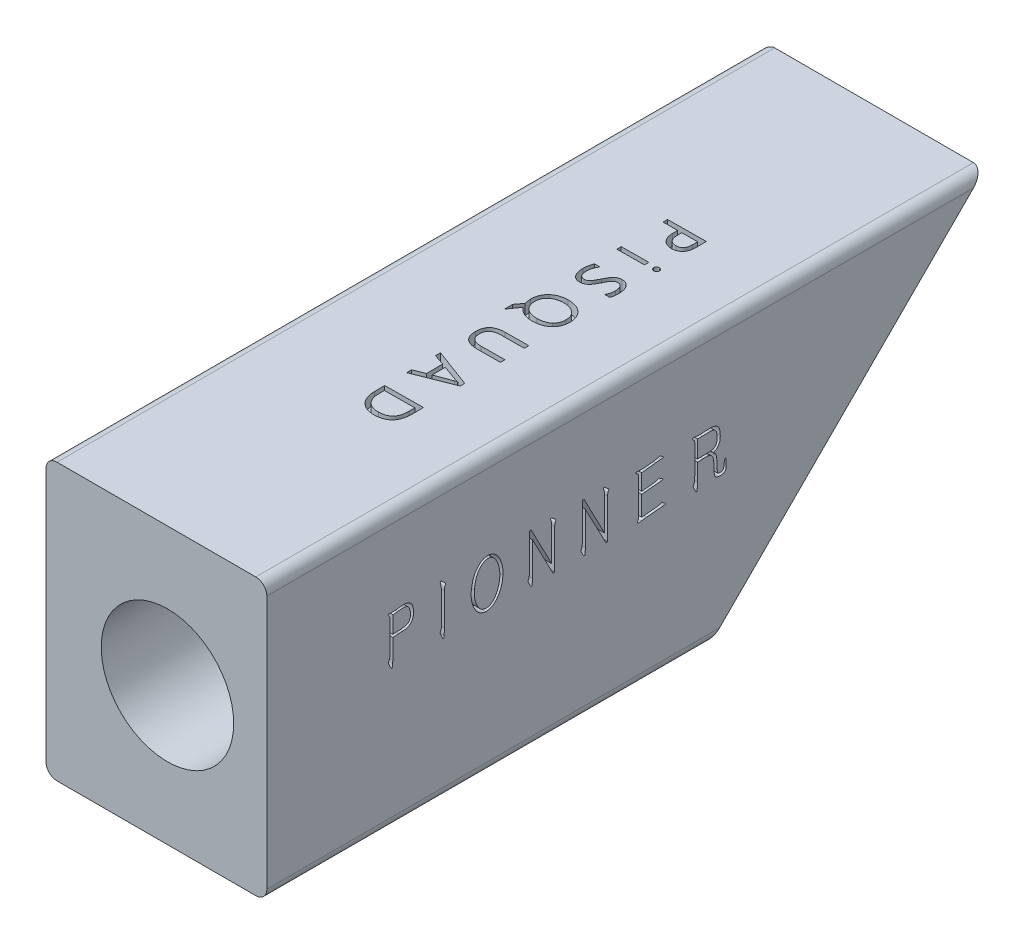
from build123d import *

# Parameters (mm, degrees)
SKETCH1_W               = 40
SKETCH1_H               = 25
BOSS_EXTRUDE1_DEPTH     = 20
CUT_EXTRUDE1_DEPTH      = 43
CUT_EXTRUDE1_DEPTH_BACK = 67
SKETCH2_R               = 6
FILLET1_R               = 1
SKETCH4_R               = 11
CUT_EXTRUDE2_DEPTH      = 2
CUT_EXTRUDE3_DEPTH      = 1
CUT_EXTRUDE4_DEPTH      = 1


with BuildPart() as part:
    # Sketch1 → Boss-Extrude1 (new body)
    with BuildSketch(Plane(origin=(0, 0, 0), x_dir=(0, 0, -1), z_dir=(1, 0, 0))):
        Polygon((20, 12.5), (45, 12.5), (20, -12.5), align=None)
        Rectangle(SKETCH1_W, SKETCH1_H)
    extrude(amount=BOSS_EXTRUDE1_DEPTH)

    # Sketch2 → Cut-Extrude1 (cut, two sides: drawn at the far end of the back side and taken through both)
    with BuildSketch(Plane.XY.offset(-CUT_EXTRUDE1_DEPTH_BACK)):
        with Locations(Location((11, 0, 0), (0, 0, 90))):
            Circle(SKETCH2_R)
    extrude(amount=CUT_EXTRUDE1_DEPTH + CUT_EXTRUDE1_DEPTH_BACK, mode=Mode.SUBTRACT)

    # Fillet1
    fillet1_edges = [part.edges().sort_by_distance(p)[0] for p in [
        (20, -12.5, 0),
        (20, 12.5, -12.5),
        (0, -12.5, 0),
        (0, 12.5, -12.5),
    ]]
    fillet(fillet1_edges, radius=FILLET1_R)

    # Sketch4 → Cut-Extrude2 (cut)
    with BuildSketch(Plane.ZY):
        Circle(SKETCH4_R)
    extrude(amount=-CUT_EXTRUDE2_DEPTH, mode=Mode.SUBTRACT)

    # Sketch5 → Cut-Extrude3 (cut)
    # profile 1 of 8: a face of its own
    with BuildSketch(Plane(origin=(0, 12.5, 0), x_dir=(1, 0, 0), z_dir=(0, 1, 0))):
        with BuildLine():
            Line((10.923109963, 26.290796431), (9.607012101, 26.279283273))
            Line((9.607012101, 26.279283273), (9.604133812, 26.687280806))
            Line((9.604133812, 26.687280806), (13.086864075, 26.717502846))
            Line((13.086864075, 26.717502846), (13.094779371, 25.761191168))
            add(Edge.make_bspline(
                [(13.094779371, 25.761191168), (13.094474458, 25.71583244), (13.093881285, 25.627592282), (13.082162329, 25.499148523), (13.062346751, 25.378533615), (13.033475802, 25.265603452), (12.996458274, 25.160313113), (12.949895034, 25.063015403), (12.895281765, 24.97324397), (12.831641437, 24.892038866), (12.761295356, 24.818410817), (12.681851906, 24.756070948), (12.596804189, 24.701216734), (12.503715053, 24.657485912), (12.40417014, 24.622668103), (12.297153221, 24.598762166), (12.183584935, 24.582257996), (12.105189105, 24.580059045), (12.065071312, 24.578933767)],
                knots=[0, 0, 0, 0, 1.221701374, 2.376678736, 3.470994319, 4.511770909, 5.513366762, 6.473054638, 7.412954823, 8.338548984, 9.248029584, 10.149322212, 11.052905708, 11.969248683, 12.913493508, 13.888572598, 14.919511302, 16, 16, 16, 16], degree=3))
            add(Edge.make_bspline(
                [(12.065071312, 24.578933767), (12.024726222, 24.579575067), (11.945414418, 24.580835757), (11.829219323, 24.596345284), (11.718453132, 24.622020727), (11.613670073, 24.659091377), (11.513932969, 24.705960715), (11.420401823, 24.764697), (11.331931996, 24.833652503), (11.249434204, 24.912473878), (11.174802559, 25.00068962), (11.109579628, 25.097265938), (11.054075883, 25.201169338), (11.008463387, 25.312791764), (10.973486006, 25.432243458), (10.947626032, 25.559063142), (10.931758536, 25.693401745), (10.9288933, 25.785374201), (10.927427398, 25.832428832)],
                knots=[0, 0, 0, 0, 1.016311944, 1.997901951, 2.948142108, 3.877399555, 4.794143846, 5.72015072, 6.654957076, 7.617047025, 8.590842581, 9.561706143, 10.548921141, 11.554840612, 12.595425369, 13.68148555, 14.813809629, 16, 16, 16, 16], degree=3))
            Line((10.927427398, 25.832428832), (10.923109963, 26.290796431))
        make_face()
        with BuildLine():
            Line((12.72060174, 26.306627023), (11.292250588, 26.293674721))
            Line((11.292250588, 26.293674721), (11.296568023, 25.866248734))
            add(Edge.make_bspline(
                [(11.296568023, 25.866248734), (11.29725283, 25.832158778), (11.29858698, 25.765744364), (11.309076975, 25.66938031), (11.324277398, 25.578987084), (11.347038554, 25.495463595), (11.373789682, 25.417703219), (11.408164196, 25.346852887), (11.447439522, 25.28144993), (11.493917783, 25.223233676), (11.544971318, 25.170976342), (11.601555423, 25.126056), (11.663158287, 25.088316431), (11.729821104, 25.05826375), (11.800921807, 25.034406571), (11.876754051, 25.016868184), (11.957871057, 25.007844882), (12.013482028, 25.006863706), (12.042044996, 25.006359753)],
                knots=[0, 0, 0, 0, 1.263550358, 2.461662288, 3.590338682, 4.658096108, 5.66784211, 6.63437192, 7.572333741, 8.490354779, 9.389576543, 10.275642468, 11.161753016, 12.061106685, 12.980676982, 13.938494696, 14.941167359, 16, 16, 16, 16], degree=3))
            add(Edge.make_bspline(
                [(12.042044996, 25.006359753), (12.06989833, 25.007369037), (12.124103965, 25.009333214), (12.202653991, 25.019319641), (12.275810768, 25.035604014), (12.343129516, 25.05905626), (12.405806558, 25.087322294), (12.462020395, 25.124069602), (12.513737097, 25.165728752), (12.559380365, 25.214469373), (12.599163887, 25.269797526), (12.633451177, 25.331272658), (12.663594437, 25.398421975), (12.685719357, 25.47268161), (12.705158593, 25.552484036), (12.716520914, 25.639313595), (12.723965673, 25.73203324), (12.724595317, 25.795953589), (12.724919174, 25.828830971)],
                knots=[0, 0, 0, 0, 1.092760076, 2.126630679, 3.10114116, 4.026408532, 4.918709526, 5.790338198, 6.652831066, 7.518039001, 8.40061612, 9.318970533, 10.275144277, 11.280851964, 12.353378912, 13.49358346, 14.710826645, 16, 16, 16, 16], degree=3))
            Line((12.724919174, 25.828830971), (12.72060174, 26.306627023))
        make_face(mode=Mode.SUBTRACT)
    # profile 2 of 8: a face of its own
    with BuildSketch(Plane(origin=(0, 12.5, 0), x_dir=(1, 0, 0), z_dir=(0, 1, 0))):
        with BuildLine():
            add(Edge.make_bspline(
                [(12.759834072, 22.281493487), (12.760609371, 22.298850627), (12.762118773, 22.332642622), (12.775582932, 22.381395664), (12.798152782, 22.426102747), (12.830069304, 22.465109383), (12.867860731, 22.498979168), (12.91274339, 22.52243246), (12.961888259, 22.538745566), (12.996674329, 22.540405506), (13.01456269, 22.541259112)],
                knots=[0, 0, 0, 0, 1.025550426, 1.996607361, 2.967871765, 3.967656224, 4.963806558, 5.948258015, 6.944913882, 8, 8, 8, 8], degree=3))
            add(Edge.make_bspline(
                [(13.01456269, 22.541259112), (13.032636839, 22.540531691), (13.067671692, 22.539121662), (13.117955788, 22.525203407), (13.162604804, 22.500578456), (13.201846867, 22.468177588), (13.235295894, 22.429990811), (13.25847196, 22.385466485), (13.273708075, 22.337163882), (13.275546077, 22.303199047), (13.276487032, 22.285810921)],
                knots=[0, 0, 0, 0, 1.062516067, 2.059576563, 3.038979646, 4.042519484, 5.044269238, 6.004549144, 6.978439021, 8, 8, 8, 8], degree=3))
            add(Edge.make_bspline(
                [(13.276487032, 22.285810921), (13.276070036, 22.268193255), (13.275250671, 22.233575867), (13.260606541, 22.184123794), (13.238321792, 22.138106852), (13.205454502, 22.098643653), (13.167342729, 22.06416817), (13.121945559, 22.040393099), (13.072249011, 22.024266975), (13.037003149, 22.022590095), (13.018880124, 22.021727862)],
                knots=[0, 0, 0, 0, 1.022706302, 2.009540815, 2.978395056, 3.982499012, 4.98309483, 5.952453026, 6.947174454, 8, 8, 8, 8], degree=3))
            add(Edge.make_bspline(
                [(13.018880124, 22.021727862), (13.001748556, 22.022456058), (12.96810397, 22.023886157), (12.919653223, 22.038295793), (12.874749727, 22.061496587), (12.835665025, 22.094959855), (12.802477706, 22.134677466), (12.778755683, 22.18018458), (12.762416721, 22.229310584), (12.760707342, 22.263848887), (12.759834072, 22.281493487)],
                knots=[0, 0, 0, 0, 1.005736925, 1.97516089, 2.947457836, 3.959514003, 4.982437541, 5.973808908, 6.964878778, 8, 8, 8, 8], degree=3))
        make_face()
    # profile 3 of 8: a face of its own
    with BuildSketch(Plane(origin=(0, 12.5, 0), x_dir=(1, 0, 0), z_dir=(0, 1, 0))):
        Polygon((9.643366144, 22.059865198), (9.639768282, 22.45850829), (12.126610387, 22.480095461), (12.130208249, 22.081452369), align=None)
    # profile 4 of 8: a face of its own
    with BuildSketch(Plane(origin=(0, 12.5, 0), x_dir=(1, 0, 0), z_dir=(0, 1, 0))):
        with BuildLine():
            Line((9.802757307, 19.898366029), (10.28343165, 19.902683463))
            add(Edge.make_bspline(
                [(10.28343165, 19.902683463), (10.259752854, 19.872823779), (10.210203558, 19.810340605), (10.151765192, 19.70159033), (10.098532648, 19.583876825), (10.055207657, 19.45947972), (10.021612242, 19.331822326), (9.996797109, 19.20494271), (9.980705548, 19.082303403), (9.979101035, 19.00254225), (9.978332965, 18.964361094)],
                knots=[0, 0, 0, 0, 0.909527534, 1.903240743, 2.94027437, 3.997658092, 5.047879587, 6.093833657, 7.087530318, 8, 8, 8, 8], degree=3))
            add(Edge.make_bspline(
                [(9.978332965, 18.964361094), (9.978948799, 18.933883337), (9.98013859, 18.875000245), (9.987456882, 18.789712542), (9.998654913, 18.710585966), (10.014613947, 18.637260175), (10.034360608, 18.56972712), (10.058969843, 18.508063788), (10.087524668, 18.452375521), (10.120928713, 18.402900386), (10.158502805, 18.359528549), (10.199796032, 18.321876275), (10.244614844, 18.289478023), (10.294106927, 18.264943884), (10.346268708, 18.243829009), (10.40311653, 18.23095482), (10.463255013, 18.221650791), (10.504780654, 18.221247973), (10.525927538, 18.221042838)],
                knots=[0, 0, 0, 0, 1.394376791, 2.693938997, 3.913771134, 5.048124552, 6.124462512, 7.129099216, 8.081302708, 8.98223275, 9.853535778, 10.700234808, 11.53454018, 12.373810629, 13.221575718, 14.102568969, 15.033735525, 16, 16, 16, 16], degree=3))
            add(Edge.make_bspline(
                [(10.525927538, 18.221042838), (10.548773106, 18.221865899), (10.593129287, 18.223463926), (10.657299404, 18.236045017), (10.716591018, 18.256166447), (10.771531995, 18.283917456), (10.822002661, 18.31952949), (10.871083867, 18.359449447), (10.917220049, 18.406067788), (10.977420744, 18.477458287), (11.047608074, 18.58140394), (11.125623471, 18.721982599), (11.204367177, 18.877469492), (11.258492369, 18.985449171), (11.286515531, 19.041355338)],
                knots=[0, 0, 0, 0, 0.694754918, 1.348912603, 1.98133275, 2.594985317, 3.214469777, 3.857415669, 4.518015618, 5.206763897, 6.696836466, 8.324553812, 10.097048341, 12, 12, 12, 12], degree=3))
            add(Edge.make_bspline(
                [(11.286515531, 19.041355338), (11.316615209, 19.100546623), (11.375142892, 19.215641831), (11.452468456, 19.355119451), (11.516998873, 19.459024329), (11.567228346, 19.531011754), (11.619997764, 19.597665689), (11.675561517, 19.659165492), (11.734309558, 19.715488752), (11.797184153, 19.765344669), (11.863650735, 19.808752909), (11.934153697, 19.845762598), (12.009650059, 19.876912699), (12.091766084, 19.897839917), (12.180039249, 19.911112282), (12.240858068, 19.913144842), (12.272329676, 19.914196621)],
                knots=[0, 0, 0, 0, 1.991748835, 3.872880072, 4.781138777, 5.659323326, 6.504255845, 7.329384323, 8.143588483, 8.942454958, 9.732657316, 10.521089169, 11.32801381, 12.176095253, 13.05619322, 14, 14, 14, 14], degree=3))
            add(Edge.make_bspline(
                [(12.272329676, 19.914196621), (12.310763446, 19.913144469), (12.385680311, 19.911093568), (12.494476036, 19.89361782), (12.59490615, 19.860433434), (12.687661562, 19.815576941), (12.772226725, 19.759717046), (12.850393358, 19.696253101), (12.919298906, 19.622741431), (12.981586245, 19.542176242), (13.034752557, 19.453827642), (13.083376952, 19.360665852), (13.122163331, 19.260476958), (13.154574776, 19.155615469), (13.179266571, 19.04725644), (13.198193503, 18.937047094), (13.210000893, 18.82549628), (13.211873555, 18.750675642), (13.212810761, 18.713230338)],
                knots=[0, 0, 0, 0, 1.080537334, 2.106232892, 3.08527093, 4.044570117, 4.994935645, 5.929370513, 6.869242421, 7.821688023, 8.787627346, 9.764991097, 10.773262619, 11.803737319, 12.849223604, 13.895992789, 14.947012566, 16, 16, 16, 16], degree=3))
            add(Edge.make_bspline(
                [(13.212810761, 18.713230338), (13.21292615, 18.671728183), (13.213148356, 18.591806459), (13.207744769, 18.476134796), (13.199643611, 18.369000519), (13.186726076, 18.270545001), (13.170190124, 18.180696108), (13.15054465, 18.09948946), (13.126400577, 18.026536364), (13.105538465, 17.98244832), (13.095520465, 17.961277213)],
                knots=[0, 0, 0, 0, 1.297668763, 2.498952813, 3.620198206, 4.656646351, 5.602616275, 6.475845398, 7.268099954, 8, 8, 8, 8], degree=3))
            Line((13.095520465, 17.961277213), (12.636433294, 17.957679351))
            add(Edge.make_bspline(
                [(12.636433294, 17.957679351), (12.653525761, 17.984230763), (12.687876323, 18.037590872), (12.729900257, 18.124041889), (12.766149713, 18.215144151), (12.7957618, 18.311834355), (12.817712134, 18.414214287), (12.833385372, 18.521662506), (12.843178135, 18.63437284), (12.843503602, 18.711290887), (12.843670136, 18.750648101)],
                knots=[0, 0, 0, 0, 0.909905766, 1.82862863, 2.766268587, 3.735546208, 4.740876976, 5.782666551, 6.865440926, 8, 8, 8, 8], degree=3))
            add(Edge.make_bspline(
                [(12.843670136, 18.750648101), (12.841728935, 18.795344346), (12.83783411, 18.88502283), (12.818843548, 18.99572955), (12.797045217, 19.082063167), (12.776895212, 19.143877459), (12.749978089, 19.201023848), (12.721199504, 19.255455517), (12.686390225, 19.304757772), (12.647984038, 19.350464781), (12.604188218, 19.390227271), (12.556374381, 19.425485979), (12.503329422, 19.454039785), (12.444561594, 19.474143969), (12.3802469, 19.48575982), (12.33570121, 19.486899718), (12.312625729, 19.487490206)],
                knots=[0, 0, 0, 0, 1.845434707, 3.702677691, 4.62241544, 5.521019363, 6.380592896, 7.226891474, 8.059114754, 8.86670774, 9.686588796, 10.494606529, 11.314068988, 12.162623364, 13.048205344, 14, 14, 14, 14], degree=3))
            add(Edge.make_bspline(
                [(12.312625729, 19.487490206), (12.290996579, 19.486798259), (12.249169927, 19.485460165), (12.188748243, 19.475189357), (12.132992811, 19.458587804), (12.081291414, 19.436074366), (12.033313693, 19.407641609), (11.98812573, 19.373154285), (11.945075395, 19.332815023), (11.888855903, 19.269222471), (11.823063625, 19.174460917), (11.761871464, 19.069090612), (11.713718804, 18.974066097), (11.674244028, 18.895823836), (11.632383723, 18.812531102), (11.604494413, 18.755001017), (11.590175071, 18.725463068)],
                knots=[0, 0, 0, 0, 0.813813059, 1.573759345, 2.299300396, 2.998757306, 3.690892312, 4.393314638, 5.134307473, 5.908072096, 7.584180529, 9.465588082, 10.491221054, 11.593505116, 12.764421722, 14, 14, 14, 14], degree=3))
            add(Edge.make_bspline(
                [(11.590175071, 18.725463068), (11.559842003, 18.664217803), (11.499991728, 18.543374567), (11.417136843, 18.398486629), (11.349086899, 18.287897202), (11.294026703, 18.212036671), (11.237316056, 18.140118425), (11.176875996, 18.07408067), (11.113669349, 18.013431628), (11.047200269, 17.959018579), (10.977092115, 17.911415889), (10.903552412, 17.869940132), (10.825385288, 17.836244878), (10.741420781, 17.81275177), (10.652200483, 17.796991553), (10.590519193, 17.795233828), (10.559027867, 17.794336423)],
                knots=[0, 0, 0, 0, 1.949593011, 3.846748396, 4.760047279, 5.65265092, 6.519433597, 7.371997273, 8.204550148, 9.016858748, 9.81977283, 10.619413753, 11.422765192, 12.241534347, 13.102216949, 14, 14, 14, 14], degree=3))
            add(Edge.make_bspline(
                [(10.559027867, 17.794336423), (10.517696167, 17.794995261), (10.437719261, 17.796270113), (10.322740644, 17.814775278), (10.217074977, 17.844316453), (10.121916847, 17.888468162), (10.035732354, 17.94264729), (9.958567005, 18.006675741), (9.888469965, 18.078359202), (9.827552878, 18.159506838), (9.774167514, 18.247977164), (9.729831617, 18.344158563), (9.691333443, 18.445874701), (9.662333003, 18.554264287), (9.640497534, 18.667151417), (9.623840037, 18.783363577), (9.613691023, 18.902784262), (9.611660431, 18.983291056), (9.610631485, 19.024085601)],
                knots=[0, 0, 0, 0, 1.12803779, 2.182754968, 3.171987688, 4.116178941, 5.037932538, 5.945768266, 6.849431976, 7.770789505, 8.711426701, 9.667077362, 10.660295621, 11.679292766, 12.727967073, 13.800188193, 14.885307481, 16, 16, 16, 16], degree=3))
            add(Edge.make_bspline(
                [(9.610631485, 19.024085601), (9.611307771, 19.055040392), (9.612798689, 19.123282301), (9.621820483, 19.2325372), (9.636241039, 19.352440247), (9.658024825, 19.476034227), (9.684391701, 19.597865234), (9.712825047, 19.695406878), (9.737744663, 19.768422249), (9.757478097, 19.817181625), (9.779257587, 19.860073188), (9.795160397, 19.885986848), (9.802757307, 19.898366029)],
                knots=[0, 0, 0, 0, 1.027653548, 2.265531062, 3.63734406, 5.035411277, 6.430209537, 7.773321957, 8.40537434, 8.990927966, 9.517957508, 10, 10, 10, 10], degree=3))
        make_face()
    # profile 5 of 8: a face of its own
    with BuildSketch(Plane(origin=(0, 12.5, 0), x_dir=(1, 0, 0), z_dir=(0, 1, 0))):
        with BuildLine():
            add(Edge.make_bspline(
                [(9.651178492, 14.231161712), (9.652205713, 14.291193888), (9.654217949, 14.408791641), (9.676365635, 14.58083738), (9.712714399, 14.744112364), (9.764674913, 14.898667119), (9.832563783, 15.043968778), (9.916157793, 15.180036258), (10.014068919, 15.307996499), (10.090411534, 15.384253692), (10.128974544, 15.422773554)],
                knots=[0, 0, 0, 0, 1.088663926, 2.132596879, 3.140843327, 4.119310026, 5.08495698, 6.044031082, 7.011979729, 8, 8, 8, 8], degree=3))
            add(Edge.make_bspline(
                [(10.128974544, 15.422773554), (10.170265867, 15.458653008), (10.252763761, 15.530338274), (10.388893265, 15.622481334), (10.534274919, 15.700236164), (10.688510503, 15.765084254), (10.852540152, 15.813947615), (11.025417723, 15.851123282), (11.207763342, 15.873402383), (11.332518973, 15.877097838), (11.396141485, 15.878982435)],
                knots=[0, 0, 0, 0, 0.951506505, 1.901060033, 2.853701638, 3.817485097, 4.808025587, 5.828315939, 6.892490914, 8, 8, 8, 8], degree=3))
            add(Edge.make_bspline(
                [(11.396141485, 15.878982435), (11.46455688, 15.878464342), (11.59835351, 15.877451133), (11.793669429, 15.856426647), (11.978668147, 15.823284715), (12.152941354, 15.775105388), (12.316255687, 15.712258827), (12.469261588, 15.635896851), (12.61141322, 15.544308923), (12.697353319, 15.472388378), (12.740302669, 15.436445429)],
                knots=[0, 0, 0, 0, 1.132913998, 2.21558431, 3.249915805, 4.243956588, 5.206314499, 6.14467739, 7.072785566, 8, 8, 8, 8], degree=3))
            add(Edge.make_bspline(
                [(12.740302669, 15.436445429), (12.780586256, 15.398001215), (12.860662925, 15.321580897), (12.963532509, 15.191596306), (13.050933981, 15.051919389), (13.123881877, 14.902401386), (13.179661365, 14.742136438), (13.219639015, 14.571855846), (13.2456122, 14.391690486), (13.249306038, 14.267951243), (13.251199051, 14.204537534)],
                knots=[0, 0, 0, 0, 0.971198436, 1.930571267, 2.884445163, 3.84332438, 4.828647213, 5.840251103, 6.893174999, 8, 8, 8, 8], degree=3))
            add(Edge.make_bspline(
                [(13.251199051, 14.204537534), (13.250478367, 14.145940355), (13.24906711, 14.031194115), (13.226694162, 13.863461303), (13.190339331, 13.704248058), (13.138151472, 13.553489535), (13.071080295, 13.410994377), (12.988413066, 13.276996037), (12.890359178, 13.151425716), (12.814102952, 13.076632236), (12.775561715, 13.038830297)],
                knots=[0, 0, 0, 0, 1.082565615, 2.119902967, 3.121332615, 4.097375783, 5.063395109, 6.026999319, 7.002810778, 8, 8, 8, 8], degree=3))
            add(Edge.make_bspline(
                [(12.775561715, 13.038830297), (12.734506216, 13.003195705), (12.652476528, 12.931997095), (12.516936118, 12.840370383), (12.371672562, 12.763478324), (12.217296255, 12.699609579), (12.053553174, 12.650255547), (11.880447693, 12.61434884), (11.697990074, 12.591693829), (11.572982674, 12.588070497), (11.509114347, 12.586219277)],
                knots=[0, 0, 0, 0, 0.947040138, 1.892204683, 2.844298732, 3.807918914, 4.799940437, 5.820891907, 6.886658012, 8, 8, 8, 8], degree=3))
            add(Edge.make_bspline(
                [(11.509114347, 12.586219277), (11.439749462, 12.586815248), (11.304559586, 12.587976774), (11.107214195, 12.607765021), (10.921195081, 12.641402223), (10.745740483, 12.68845857), (10.581781112, 12.751483369), (10.428702609, 12.827928822), (10.28559101, 12.917652536), (10.200373358, 12.989798838), (10.157757439, 13.025877994)],
                knots=[0, 0, 0, 0, 1.143962991, 2.22954618, 3.267303387, 4.259919065, 5.221914841, 6.15986042, 7.079777032, 8, 8, 8, 8], degree=3))
            add(Edge.make_bspline(
                [(10.157757439, 13.025877994), (10.119458647, 13.061317097), (10.044157212, 13.130995935), (9.981855052, 13.212495115), (9.951240169, 13.25254329)],
                knots=[0, 0, 0, 0, 1.017212798, 2, 2, 2, 2], degree=3))
            Line((9.951240169, 13.25254329), (9.258291979, 12.267448718))
            Line((9.258291979, 12.267448718), (9.251815827, 13.007888685))
            Line((9.251815827, 13.007888685), (9.736088031, 13.668456119))
            add(Edge.make_bspline(
                [(9.736088031, 13.668456119), (9.723296924, 13.711917077), (9.69726725, 13.800359349), (9.672750622, 13.938579551), (9.655186299, 14.082729008), (9.652533578, 14.180974906), (9.651178492, 14.231161712)],
                knots=[0, 0, 0, 0, 0.951317699, 1.935914497, 2.945606265, 4, 4, 4, 4], degree=3))
        make_face()
        with BuildLine():
            add(Edge.make_bspline(
                [(12.882058426, 14.229722567), (12.880669301, 14.274425301), (12.877943759, 14.362134608), (12.856725149, 14.490001712), (12.825808296, 14.611940553), (12.780383656, 14.726682667), (12.724591806, 14.835730026), (12.654161198, 14.936812614), (12.573273784, 15.032753786), (12.510279709, 15.089126612), (12.478378327, 15.117674869)],
                knots=[0, 0, 0, 0, 1.063891147, 2.08741491, 3.079326943, 4.054070689, 5.019719015, 5.98927823, 6.981732772, 8, 8, 8, 8], degree=3))
            add(Edge.make_bspline(
                [(12.478378327, 15.117674869), (12.444413946, 15.145101026), (12.376647912, 15.199821938), (12.264196903, 15.267839084), (12.145379202, 15.326881416), (12.017685378, 15.373119713), (11.88305837, 15.410308265), (11.74033953, 15.434670198), (11.59055656, 15.450651789), (11.488050812, 15.451250689), (11.435717965, 15.451556448)],
                knots=[0, 0, 0, 0, 0.93525518, 1.866029459, 2.811540909, 3.776648883, 4.77370362, 5.802934709, 6.878319687, 8, 8, 8, 8], degree=3))
            add(Edge.make_bspline(
                [(11.435717965, 15.451556448), (11.383617641, 15.450220346), (11.281527975, 15.447602277), (11.132412252, 15.429835291), (10.990903187, 15.402760496), (10.857086597, 15.365555089), (10.731363828, 15.317192962), (10.613510874, 15.25840401), (10.502267482, 15.190602875), (10.435188099, 15.136203803), (10.401692472, 15.109040001)],
                knots=[0, 0, 0, 0, 1.124169595, 2.202790443, 3.236188269, 4.230866631, 5.195961516, 6.138088872, 7.070267524, 8, 8, 8, 8], degree=3))
            add(Edge.make_bspline(
                [(10.401692472, 15.109040001), (10.370801958, 15.080427331), (10.310031148, 15.024137714), (10.231327624, 14.929359811), (10.163822405, 14.829408939), (10.109476708, 14.722511694), (10.067492485, 14.609508294), (10.038160404, 14.490011208), (10.020452857, 14.36434103), (10.018933734, 14.278472373), (10.0181604, 14.234759573)],
                knots=[0, 0, 0, 0, 1.022999759, 2.012544204, 2.988047181, 3.950629948, 4.921413144, 5.913104128, 6.937632589, 8, 8, 8, 8], degree=3))
            add(Edge.make_bspline(
                [(10.0181604, 14.234759573), (10.019671925, 14.188158679), (10.02262168, 14.097216627), (10.041850634, 13.96471863), (10.07150649, 13.839889796), (10.113973433, 13.722844516), (10.166604627, 13.612814631), (10.2333962, 13.511844048), (10.30930954, 13.416720799), (10.369258214, 13.361661337), (10.399533755, 13.333854968)],
                knots=[0, 0, 0, 0, 1.107541294, 2.161376514, 3.176370973, 4.1520447, 5.115902815, 6.067901108, 7.024242986, 8, 8, 8, 8], degree=3))
            add(Edge.make_bspline(
                [(10.399533755, 13.333854968), (10.43181209, 13.307615535), (10.497039523, 13.254591398), (10.606752591, 13.189324479), (10.724337396, 13.132228871), (10.85222287, 13.088418468), (10.988253216, 13.052745213), (11.133995625, 13.028878409), (11.288608753, 13.014023212), (11.394906154, 13.013297607), (11.44938984, 13.012925692)],
                knots=[0, 0, 0, 0, 0.888630798, 1.795727863, 2.722741428, 3.680021302, 4.681662972, 5.727458161, 6.835188288, 8, 8, 8, 8], degree=3))
            add(Edge.make_bspline(
                [(11.44938984, 13.012925692), (11.505565359, 13.014270865), (11.614565493, 13.016880971), (11.77292559, 13.034110292), (11.92161616, 13.059057441), (12.059921996, 13.095979693), (12.188501803, 13.141942457), (12.306895515, 13.198209144), (12.416127653, 13.26401741), (12.480873475, 13.316991304), (12.512917801, 13.343209409)],
                knots=[0, 0, 0, 0, 1.185406818, 2.300103399, 3.358699395, 4.364325713, 5.31709008, 6.236387207, 7.127143925, 8, 8, 8, 8], degree=3))
            add(Edge.make_bspline(
                [(12.512917801, 13.343209409), (12.542925796, 13.370549152), (12.602324202, 13.424665969), (12.677939892, 13.518178854), (12.742512766, 13.618394693), (12.794435332, 13.726595378), (12.834854501, 13.841717107), (12.863673177, 13.96419465), (12.880524232, 14.094443453), (12.88153829, 14.183859056), (12.882058426, 14.229722567)],
                knots=[0, 0, 0, 0, 0.979966963, 1.939765557, 2.896635711, 3.856014001, 4.83330214, 5.840132684, 6.89214975, 8, 8, 8, 8], degree=3))
        make_face(mode=Mode.SUBTRACT)
    # profile 6 of 8: a face of its own
    with BuildSketch(Plane(origin=(0, 12.5, 0), x_dir=(1, 0, 0), z_dir=(0, 1, 0))):
        with BuildLine():
            add(Edge.make_bspline(
                [(11.17263268, 7.896234054), (11.113354908, 7.896589698), (10.998443221, 7.897279125), (10.83160753, 7.912136743), (10.676148947, 7.936005648), (10.531806178, 7.970411852), (10.398815982, 8.015467411), (10.277265052, 8.071755099), (10.16701653, 8.13810545), (10.068075228, 8.215039022), (9.980379094, 8.302606996), (9.904309266, 8.400976642), (9.840917786, 8.510536438), (9.787247783, 8.629377535), (9.746526315, 8.759209251), (9.717446005, 8.899024198), (9.698282652, 9.049192174), (9.695398742, 9.153026355), (9.693911463, 9.206575337)],
                knots=[0, 0, 0, 0, 1.255745004, 2.434298259, 3.545733077, 4.586248364, 5.574812864, 6.516297513, 7.419404238, 8.295855165, 9.16564817, 10.038983591, 10.922948769, 11.84211923, 12.796982904, 13.799883164, 14.865363819, 16, 16, 16, 16], degree=3))
            add(Edge.make_bspline(
                [(9.693911463, 9.206575337), (9.694553515, 9.257699569), (9.695801505, 9.357072532), (9.710792366, 9.501374235), (9.737472396, 9.635974908), (9.774423086, 9.761168989), (9.823569065, 9.876299192), (9.883746617, 9.981547066), (9.954470639, 10.0774758), (10.037237365, 10.162804575), (10.131094977, 10.238289028), (10.235968645, 10.303824212), (10.352057206, 10.359522832), (10.479386444, 10.404331191), (10.617480567, 10.440560431), (10.766811286, 10.465648539), (10.926874609, 10.482709452), (11.037306344, 10.485339576), (11.094199292, 10.48669458)],
                knots=[0, 0, 0, 0, 1.128084499, 2.192719487, 3.196710497, 4.153063646, 5.0685707, 5.953076793, 6.823432431, 7.69204742, 8.569283193, 9.475575022, 10.415611896, 11.405263457, 12.450504079, 13.562826144, 14.744400728, 16, 16, 16, 16], degree=3))
            Line((11.094199292, 10.48669458), (13.224133503, 10.505403462))
            Line((13.224133503, 10.505403462), (13.227731364, 10.097405929))
            Line((13.227731364, 10.097405929), (11.124421332, 10.07941662))
            add(Edge.make_bspline(
                [(11.124421332, 10.07941662), (11.081213238, 10.078608887), (10.997255448, 10.077039378), (10.875910259, 10.064376462), (10.762901143, 10.045874625), (10.658100499, 10.020933292), (10.561534237, 9.98895481), (10.473529765, 9.949069519), (10.394139719, 9.902288499), (10.322480086, 9.848661531), (10.260089642, 9.787497857), (10.20569089, 9.719484267), (10.160707453, 9.644188997), (10.122583979, 9.562480709), (10.094987933, 9.473003594), (10.07513699, 9.37711325), (10.062245568, 9.274325014), (10.061828081, 9.203497451), (10.061612943, 9.166998857)],
                knots=[0, 0, 0, 0, 1.293016469, 2.512464564, 3.647905691, 4.718821718, 5.733665093, 6.687909281, 7.605221135, 8.48686072, 9.36009991, 10.213366299, 11.086339829, 11.979393733, 12.905791565, 13.881587772, 14.908347721, 16, 16, 16, 16], degree=3))
            add(Edge.make_bspline(
                [(10.061612943, 9.166998857), (10.062678943, 9.131698627), (10.064745828, 9.063254358), (10.077826172, 8.964239546), (10.098635569, 8.872176217), (10.127176647, 8.786488662), (10.164915024, 8.708046238), (10.209462045, 8.635678246), (10.263545075, 8.571366255), (10.324881389, 8.513301438), (10.394821916, 8.462817047), (10.472163869, 8.418710621), (10.557852393, 8.381862643), (10.651594527, 8.352922061), (10.753098677, 8.329791942), (10.862520788, 8.313473807), (10.980096235, 8.304024276), (11.061081122, 8.303686276), (11.10283416, 8.303512015)],
                knots=[0, 0, 0, 0, 1.094183675, 2.121533006, 3.090082854, 4.016449421, 4.914362449, 5.782858456, 6.643425747, 7.511285027, 8.3946433, 9.310386804, 10.266153273, 11.279634242, 12.347379143, 13.490364018, 14.706117482, 16, 16, 16, 16], degree=3))
            Line((11.10283416, 8.303512015), (13.242842384, 8.322220896))
            Line((13.242842384, 8.322220896), (13.246440246, 7.914223363))
            Line((13.246440246, 7.914223363), (11.17263268, 7.896234054))
        make_face()
    # profile 7 of 8: a face of its own
    with BuildSketch(Plane(origin=(0, 12.5, 0), x_dir=(1, 0, 0), z_dir=(0, 1, 0))):
        Polygon((9.806584918, 2.854366329), (9.802987056, 3.306257777), (10.775848898, 3.68403327), (10.762896595, 5.16059577), (9.783558602, 5.499514356), (9.77996074, 5.95356452), (13.274204161, 4.647540671), (13.277802023, 4.225151691), align=None)
        with BuildLine():
            Line((11.141391661, 3.82075202), (12.620832451, 4.37985975))
            add(Edge.make_bspline(
                [(12.620832451, 4.37985975), (12.634688153, 4.384605307), (12.665668499, 4.395216028), (12.718759635, 4.408208389), (12.782185608, 4.422867956), (12.828499749, 4.430948063), (12.853254326, 4.435266823)],
                knots=[0, 0, 0, 0, 0.734400858, 1.642067073, 2.739701698, 4, 4, 4, 4], degree=3))
            Line((12.853254326, 4.435266823), (12.853254326, 4.445340836))
            add(Edge.make_bspline(
                [(12.853254326, 4.445340836), (12.829700242, 4.448921485), (12.785304301, 4.455670476), (12.723052306, 4.469131008), (12.668237705, 4.481991825), (12.634914998, 4.493314907), (12.619393306, 4.498589191)],
                knots=[0, 0, 0, 0, 1.189875312, 2.242737785, 3.181468564, 4, 4, 4, 4], degree=3))
            Line((12.619393306, 4.498589191), (11.130598076, 5.027474882))
            Line((11.130598076, 5.027474882), (11.141391661, 3.82075202))
        make_face(mode=Mode.SUBTRACT)
    # profile 8 of 8: a face of its own
    with BuildSketch(Plane(origin=(0, 12.5, 0), x_dir=(1, 0, 0), z_dir=(0, 1, 0))):
        with BuildLine():
            Line((9.823430778, 0.852685225), (13.306161041, 0.882907264))
            Line((13.306161041, 0.882907264), (13.314076337, -0.07844142))
            add(Edge.make_bspline(
                [(13.314076337, -0.07844142), (13.313400969, -0.152838232), (13.312091623, -0.297072389), (13.293723135, -0.506231077), (13.263841208, -0.701395481), (13.218179177, -0.882124816), (13.160219308, -1.049032592), (13.089252101, -1.201994663), (13.003563688, -1.340078116), (12.904350096, -1.464078611), (12.791759622, -1.574201935), (12.665030289, -1.668855583), (12.526108972, -1.750360781), (12.372727401, -1.815430066), (12.206677896, -1.867371794), (12.027049421, -1.904044589), (11.834341796, -1.928579027), (11.701114918, -1.931825441), (11.632435712, -1.933498986)],
                knots=[0, 0, 0, 0, 1.24331188, 2.410426437, 3.506678418, 4.540432577, 5.521956406, 6.45649141, 7.353294106, 8.231858403, 9.105191738, 9.978497459, 10.869761397, 11.791128886, 12.757482234, 13.773502262, 14.852227864, 16, 16, 16, 16], degree=3))
            add(Edge.make_bspline(
                [(11.632435712, -1.933498986), (11.566885241, -1.932534191), (11.438497709, -1.930644539), (11.250661147, -1.907634343), (11.07225626, -1.870393513), (10.904315736, -1.814774749), (10.745158361, -1.745326777), (10.596855725, -1.657399116), (10.457394195, -1.554837711), (10.329736364, -1.435857819), (10.214087293, -1.303850249), (10.112615613, -1.160055449), (10.02748084, -1.004573752), (9.956682341, -0.838876669), (9.902211276, -0.661705345), (9.861875687, -0.474233697), (9.837239718, -0.275527059), (9.833340851, -0.13943522), (9.831346074, -0.069806552)],
                knots=[0, 0, 0, 0, 1.075707618, 2.106887177, 3.101759431, 4.063192053, 5.006466672, 5.947329463, 6.887788306, 7.843631273, 8.806490468, 9.764699467, 10.727099488, 11.711676359, 12.718126386, 13.765534593, 14.856780446, 16, 16, 16, 16], degree=3))
            Line((9.831346074, -0.069806552), (9.823430778, 0.852685225))
        make_face()
        with BuildLine():
            Line((12.939898705, 0.472031442), (10.195449692, 0.447565981))
            Line((10.195449692, 0.447565981), (10.200486699, -0.071965269))
            add(Edge.make_bspline(
                [(10.200486699, -0.071965269), (10.201977487, -0.127433717), (10.204883812, -0.235570672), (10.224289043, -0.392836381), (10.252785919, -0.540992799), (10.295109029, -0.679061569), (10.347377971, -0.808082997), (10.411685027, -0.927185828), (10.486935795, -1.037160648), (10.574270878, -1.13627227), (10.67146314, -1.225246325), (10.779065977, -1.302119765), (10.89597704, -1.366859329), (11.02234547, -1.419895377), (11.158346981, -1.459746222), (11.3035236, -1.488470394), (11.458137555, -1.505259135), (11.564274158, -1.50627238), (11.618763837, -1.506792571)],
                knots=[0, 0, 0, 0, 1.160330371, 2.262089454, 3.311229952, 4.312958466, 5.278431758, 6.219239913, 7.139355944, 8.060402105, 8.976911841, 9.890476673, 10.820488686, 11.767420299, 12.751840806, 13.780313904, 14.860430986, 16, 16, 16, 16], degree=3))
            add(Edge.make_bspline(
                [(11.618763837, -1.506792571), (11.672785584, -1.505231267), (11.777771769, -1.502197019), (11.929851024, -1.483953692), (12.07164776, -1.45578495), (12.202565851, -1.415430086), (12.322946922, -1.364128489), (12.43331879, -1.302357315), (12.53253021, -1.228137682), (12.621709607, -1.14359935), (12.700136739, -1.047687446), (12.767189147, -0.940422904), (12.823221488, -0.822151147), (12.869577531, -0.693297043), (12.904120687, -0.553336052), (12.929427927, -0.402559376), (12.943761446, -0.240868947), (12.94453697, -0.129319368), (12.944935712, -0.071965269)],
                knots=[0, 0, 0, 0, 1.157169228, 2.248849562, 3.276635533, 4.250088393, 5.177718135, 6.075014209, 6.95257335, 7.824776733, 8.70105649, 9.599131844, 10.527558054, 11.49942322, 12.527478841, 13.611186569, 14.771772642, 16, 16, 16, 16], degree=3))
            Line((12.944935712, -0.071965269), (12.939898705, 0.472031442))
        make_face(mode=Mode.SUBTRACT)
    extrude(amount=-CUT_EXTRUDE3_DEPTH, mode=Mode.SUBTRACT)

    # Sketch6 → Cut-Extrude4 (cut)
    # profile 1 of 7: a face of its own
    with BuildSketch(Plane(origin=(20, 0, 0), x_dir=(0, 0, -1), z_dir=(1, 0, 0))):
        with BuildLine():
            add(Edge.make_bspline(
                [(-8.5005662, 4.548107663), (-8.424349524, 4.556687568), (-8.278718385, 4.573081637), (-8.066728304, 4.601582542), (-7.862045744, 4.625487805), (-7.726029703, 4.631671626), (-7.657338962, 4.634794575)],
                knots=[0, 0, 0, 0, 1.085326249, 2.073788935, 3.02722601, 4, 4, 4, 4], degree=3))
            add(Edge.make_bspline(
                [(-7.657338962, 4.634794575), (-7.617922542, 4.635371889), (-7.543284685, 4.636465073), (-7.437679228, 4.629211283), (-7.344120488, 4.61753851), (-7.261134192, 4.59644454), (-7.185145477, 4.566610005), (-7.111430291, 4.52947631), (-7.040656752, 4.479926243), (-6.970177713, 4.42285922), (-6.906095681, 4.352499977), (-6.849863269, 4.269804891), (-6.805995103, 4.172925933), (-6.773149467, 4.065886178), (-6.747626726, 3.955010447), (-6.727531118, 3.84524828), (-6.714552271, 3.738666392), (-6.708882502, 3.636008485), (-6.70856086, 3.53863023), (-6.714420784, 3.447805763), (-6.725549058, 3.363635179), (-6.738774444, 3.310754175), (-6.745156225, 3.285236963)],
                knots=[0, 0, 0, 0, 1.217979337, 2.306332456, 3.269497102, 4.128642705, 4.944804995, 5.789134025, 6.673101869, 7.610079967, 8.587103045, 9.603353762, 10.688673668, 11.860308523, 13.059277742, 14.204050539, 15.308144684, 16.375615156, 17.380448108, 18.316215995, 19.187506443, 20, 20, 20, 20], degree=3))
            add(Edge.make_bspline(
                [(-6.745156225, 3.285236963), (-6.753945222, 3.255230328), (-6.771151279, 3.196486894), (-6.803401323, 3.111971622), (-6.843357777, 3.034382989), (-6.886895454, 2.962184953), (-6.937146295, 2.898065403), (-6.989720972, 2.839191959), (-7.04851732, 2.788999522), (-7.131156385, 2.731114575), (-7.244228749, 2.675416452), (-7.387708781, 2.632622807), (-7.533269238, 2.612121834), (-7.629707968, 2.608362795), (-7.677040533, 2.606517842)],
                knots=[0, 0, 0, 0, 0.895463538, 1.753032419, 2.585849702, 3.392389525, 4.16366611, 4.915898757, 5.649376957, 6.372103415, 7.802175461, 9.236324082, 10.643575361, 12, 12, 12, 12], degree=3))
            Line((-7.677040533, 2.606517842), (-8.064176403, 2.593711821))
            Line((-8.064176403, 2.593711821), (-8.580357563, 2.54642805))
            Line((-8.580357563, 2.54642805), (-8.590208348, 0.764420954))
            add(Edge.make_bspline(
                [(-8.590208348, 0.764420954), (-8.59176345, 0.725013707), (-8.594563241, 0.6540653), (-8.599421959, 0.559489389), (-8.604012623, 0.488188786), (-8.610584789, 0.4220737), (-8.622096816, 0.349345422), (-8.635023752, 0.279234347), (-8.648736321, 0.225365152), (-8.658162845, 0.197179617), (-8.67190803, 0.176903721), (-8.683866188, 0.178597379), (-8.688716203, 0.179284296)],
                knots=[0, 0, 0, 0, 1.936165496, 3.485852713, 4.649340273, 5.443357571, 6.747443505, 8.258670106, 8.958576954, 9.443540233, 9.774309852, 10, 10, 10, 10], degree=3))
            add(Edge.make_bspline(
                [(-8.688716203, 0.179284296), (-8.690679259, 0.180281533), (-8.699185835, 0.184602895), (-8.718277536, 0.192397718), (-8.742048733, 0.216600609), (-8.752618516, 0.239871235), (-8.75865678, 0.253165187)],
                knots=[0, 0, 0, 0, 0.251703416, 1.090714801, 2.337994894, 4, 4, 4, 4], degree=3))
            Line((-8.75865678, 0.253165187), (-8.807910708, 0.338867021))
            Line((-8.807910708, 0.338867021), (-8.927105212, 0.578241109))
            add(Edge.make_bspline(
                [(-8.927105212, 0.578241109), (-8.938750633, 0.60111905), (-8.958918006, 0.640738741), (-8.983065956, 0.692889511), (-8.997470067, 0.726896465), (-9.004917421, 0.755357637), (-8.986520045, 0.782231976), (-8.964475585, 0.817945593), (-8.935039218, 0.86569999), (-8.911380264, 0.925239554), (-8.889126997, 0.988582364), (-8.871618694, 1.055677953), (-8.858644529, 1.129046689), (-8.857295356, 1.199493779), (-8.856226768, 1.268783168), (-8.854083525, 1.338074394), (-8.851182491, 1.422133834), (-8.848666599, 1.483201113), (-8.84731385, 1.516035888)],
                knots=[0, 0, 0, 0, 1.254230058, 2.172057588, 2.791083131, 3.083529528, 3.542443293, 4.262720784, 5.189043674, 6.25172339, 7.386968099, 8.463693443, 9.633479031, 11.013201902, 11.894775591, 13.01705085, 14.396122052, 16, 16, 16, 16], degree=3))
            Line((-8.84731385, 1.516035888), (-8.827612279, 4.255539334))
            add(Edge.make_bspline(
                [(-8.827612279, 4.255539334), (-8.849353565, 4.284280864), (-8.88975763, 4.337694202), (-8.945285817, 4.395274679), (-8.982739361, 4.434456989), (-9.002929541, 4.458926416), (-9.018222506, 4.478715177), (-9.028508728, 4.500714701), (-9.033647709, 4.523565634), (-9.035585507, 4.540543044), (-9.036448931, 4.548107663)],
                knots=[0, 0, 0, 0, 2.362435807, 4.390357145, 5.244160012, 5.917342317, 6.473432076, 6.878283, 7.500196929, 8, 8, 8, 8], degree=3))
            add(Edge.make_bspline(
                [(-9.036448931, 4.548107663), (-9.034833832, 4.552073523), (-9.030561413, 4.562564405), (-9.007492405, 4.568587211), (-8.976640708, 4.569059304), (-8.951500494, 4.568267386), (-8.936955998, 4.567809234)],
                knots=[0, 0, 0, 0, 0.458891966, 1.213906121, 2.388146974, 4, 4, 4, 4], degree=3))
            Line((-8.936955998, 4.567809234), (-8.837463064, 4.555003213))
            Line((-8.837463064, 4.555003213), (-8.5005662, 4.548107663))
        make_face()
        with BuildLine():
            Line((-8.580357563, 2.779891667), (-7.915429542, 2.826190359))
            add(Edge.make_bspline(
                [(-7.915429542, 2.826190359), (-7.855966004, 2.83031808), (-7.730116502, 2.839054051), (-7.570996272, 2.858135274), (-7.442015359, 2.884453901), (-7.351610155, 2.91002411), (-7.271990685, 2.945374488), (-7.200832578, 2.985959125), (-7.140555294, 3.037439264), (-7.090001467, 3.098137402), (-7.052730769, 3.170796099), (-7.017029589, 3.280377352), (-6.988440371, 3.427964699), (-6.984534124, 3.549099199), (-6.982560155, 3.610312884)],
                knots=[0, 0, 0, 0, 1.50603457, 3.187393613, 4.043194499, 4.83064543, 5.555049745, 6.239394857, 6.892663738, 7.54698526, 8.222371728, 8.941196834, 10.454275112, 12, 12, 12, 12], degree=3))
            add(Edge.make_bspline(
                [(-6.982560155, 3.610312884), (-6.986277256, 3.6491301), (-6.993556707, 3.725148512), (-7.013465238, 3.83502945), (-7.039193128, 3.938340957), (-7.069999754, 4.034138438), (-7.106372551, 4.120053368), (-7.148872732, 4.193972143), (-7.198221187, 4.25354349), (-7.25427792, 4.301368614), (-7.320447702, 4.335782836), (-7.395177401, 4.364798941), (-7.482652099, 4.383659616), (-7.54464428, 4.391342616), (-7.577547599, 4.395420488)],
                knots=[0, 0, 0, 0, 1.274559765, 2.496057682, 3.647007231, 4.753845717, 5.782972715, 6.692593144, 7.531132395, 8.300940148, 9.084108462, 9.957459912, 10.915889896, 12, 12, 12, 12], degree=3))
            add(Edge.make_bspline(
                [(-7.577547599, 4.395420488), (-7.621547957, 4.396973407), (-7.711536622, 4.400149406), (-7.849939249, 4.394075032), (-7.994664939, 4.382973276), (-8.092804961, 4.369047756), (-8.142982687, 4.361927817)],
                knots=[0, 0, 0, 0, 0.930928584, 1.903916816, 2.92829975, 4, 4, 4, 4], degree=3))
            Line((-8.142982687, 4.361927817), (-8.549820128, 4.301838026))
            Line((-8.549820128, 4.301838026), (-8.580357563, 2.779891667))
        make_face(mode=Mode.SUBTRACT)
    # profile 2 of 7: a face of its own
    with BuildSketch(Plane(origin=(20, 0, 0), x_dir=(0, 0, -1), z_dir=(1, 0, 0))):
        with BuildLine():
            Line((-4.308071894, 4.741183059), (-4.228280531, 4.80127285))
            Line((-4.228280531, 4.80127285), (-3.791890734, 4.408226509))
            add(Edge.make_bspline(
                [(-3.791890734, 4.408226509), (-3.801108404, 4.385758484), (-3.818190345, 4.344121339), (-3.847813898, 4.28523229), (-3.873795131, 4.222779463), (-3.890187508, 4.161267182), (-3.901911008, 4.098280608), (-3.90675346, 4.033635527), (-3.911016311, 3.953836167), (-3.911060934, 3.895338899), (-3.911085238, 3.863478071)],
                knots=[0, 0, 0, 0, 1.030819391, 1.910287074, 2.7984446, 3.897900794, 4.606305599, 5.51651908, 6.647359745, 8, 8, 8, 8], degree=3))
            Line((-3.911085238, 3.863478071), (-3.911085238, 0.9506008))
            Line((-3.911085238, 0.9506008), (-3.940637595, 0.398956813))
            add(Edge.make_bspline(
                [(-3.940637595, 0.398956813), (-3.941434975, 0.368287632), (-3.94290264, 0.311837714), (-3.958667305, 0.246939435), (-3.975570619, 0.206906242), (-3.98598249, 0.18823588), (-3.998525214, 0.176471972), (-4.006848245, 0.17841399), (-4.010578172, 0.179284296)],
                knots=[0, 0, 0, 0, 2.244590828, 4.131410234, 4.865123313, 5.406373378, 5.733969036, 6, 6, 6, 6], degree=3))
            add(Edge.make_bspline(
                [(-4.010578172, 0.179284296), (-4.014513423, 0.180228986), (-4.024593097, 0.182648695), (-4.044325111, 0.188880093), (-4.064575056, 0.215312199), (-4.073839376, 0.238755693), (-4.07953367, 0.253165187)],
                knots=[0, 0, 0, 0, 0.454594332, 1.164388975, 2.257097757, 4, 4, 4, 4], degree=3))
            Line((-4.07953367, 0.253165187), (-4.128787598, 0.338867021))
            Line((-4.128787598, 0.338867021), (-4.238131317, 0.578241109))
            add(Edge.make_bspline(
                [(-4.238131317, 0.578241109), (-4.249786016, 0.601123002), (-4.269969457, 0.640749536), (-4.294030782, 0.692863413), (-4.308613572, 0.726946466), (-4.315643497, 0.754999509), (-4.300235112, 0.781973851), (-4.281596582, 0.818690331), (-4.254866942, 0.867773633), (-4.232395149, 0.928522832), (-4.212592147, 0.991686694), (-4.198271868, 1.052316831), (-4.18962056, 1.108699241), (-4.183575523, 1.159308674), (-4.181593567, 1.215909379), (-4.179491048, 1.288792089), (-4.178848434, 1.392245477), (-4.178962331, 1.471379964), (-4.179026604, 1.516035888)],
                knots=[0, 0, 0, 0, 1.262213397, 2.185883019, 2.80884874, 3.103156597, 3.552429886, 4.24499434, 5.168241455, 6.276386832, 7.424195404, 8.417866919, 9.332622925, 10.224923974, 10.919176468, 12.113082147, 13.806595919, 16, 16, 16, 16], degree=3))
            Line((-4.179026604, 1.516035888), (-4.179026604, 3.956075455))
            add(Edge.make_bspline(
                [(-4.179026604, 3.956075455), (-4.179749046, 4.005356907), (-4.181133207, 4.09977756), (-4.19248894, 4.235193288), (-4.208117723, 4.358088981), (-4.231512803, 4.465273023), (-4.252482212, 4.553493356), (-4.263184437, 4.605876886), (-4.267683673, 4.627899026)],
                knots=[0, 0, 0, 0, 1.305159305, 2.500616095, 3.597871127, 4.583854219, 5.404649529, 6, 6, 6, 6], degree=3))
            Line((-4.267683673, 4.627899026), (-4.308071894, 4.741183059))
        make_face()
    # profile 3 of 7: a face of its own
    with BuildSketch(Plane(origin=(20, 0, 0), x_dir=(0, 0, -1), z_dir=(1, 0, 0))):
        with BuildLine():
            add(Edge.make_bspline(
                [(-1.486806928, 2.593711821), (-1.480655777, 2.65750617), (-1.467954173, 2.789236084), (-1.433592205, 2.991083686), (-1.386349702, 3.203105002), (-1.330840832, 3.422258557), (-1.258438609, 3.6395591), (-1.161868497, 3.84318578), (-1.0431648, 4.029306068), (-0.928619164, 4.169631333), (-0.829587718, 4.270158189), (-0.757785239, 4.339300792), (-0.688161292, 4.401546671), (-0.619745075, 4.456115453), (-0.553190244, 4.503516717), (-0.487826463, 4.543019541), (-0.42476345, 4.575922878), (-0.344308832, 4.609401708), (-0.247111094, 4.639262212), (-0.135190067, 4.665131896), (-0.030045459, 4.681645626), (0.038042342, 4.681271957), (0.070602259, 4.681093267)],
                knots=[0, 0, 0, 0, 1.344663345, 2.776615648, 4.293167882, 5.902728899, 7.519692739, 9.091686609, 10.619096458, 12.142007298, 12.882717602, 13.579663062, 14.233763741, 14.841813897, 15.415383522, 15.947197256, 16.443397056, 16.906685451, 17.774075871, 18.573104992, 19.317651874, 20, 20, 20, 20], degree=3))
            add(Edge.make_bspline(
                [(0.070602259, 4.681093267), (0.101582141, 4.67748501), (0.166847167, 4.669883529), (0.2672976, 4.644049127), (0.375268709, 4.607130012), (0.488971026, 4.558907429), (0.603410879, 4.497142631), (0.712036683, 4.418737086), (0.810932286, 4.322859), (0.900301608, 4.212525282), (0.981763777, 4.092998461), (1.056835311, 3.968724501), (1.124416506, 3.840448156), (1.182429205, 3.706452771), (1.23371672, 3.566903772), (1.279252451, 3.420308737), (1.318575451, 3.265818698), (1.350656695, 3.104685266), (1.375126544, 2.940325404), (1.391469361, 2.775328162), (1.396550338, 2.610752427), (1.391927114, 2.501431555), (1.389622437, 2.446935117)],
                knots=[0, 0, 0, 0, 0.656841806, 1.383762439, 2.180521236, 3.061223149, 3.98431701, 4.916115475, 5.875627503, 6.878882386, 7.904150001, 8.922666192, 9.938167342, 10.95795283, 11.998181874, 13.070948933, 14.192387039, 15.357101699, 16.53276865, 17.694002145, 18.850460412, 20, 20, 20, 20], degree=3))
            add(Edge.make_bspline(
                [(1.389622437, 2.446935117), (1.387050506, 2.40585824), (1.38170905, 2.320548665), (1.365746956, 2.188999655), (1.34162233, 2.049392754), (1.310619475, 1.903347501), (1.271372627, 1.752979086), (1.223625531, 1.601370396), (1.164398494, 1.45030983), (1.098926034, 1.299475213), (1.021985306, 1.15296252), (0.935958487, 1.012484864), (0.837155829, 0.881633931), (0.732651778, 0.758180814), (0.621297381, 0.648646501), (0.504309083, 0.557427066), (0.384773703, 0.484601188), (0.261744572, 0.433889915), (0.142885302, 0.399860333), (0.031845313, 0.374880283), (-0.071006724, 0.363441037), (-0.136575877, 0.364811705), (-0.16778675, 0.365464142)],
                knots=[0, 0, 0, 0, 0.863569761, 1.793485184, 2.779050933, 3.835917636, 4.925632295, 6.039224736, 7.169176829, 8.32919436, 9.488085711, 10.639227942, 11.78171687, 12.925244329, 14.031392773, 15.052754685, 16.032425156, 16.958964451, 17.835468423, 18.62474924, 19.34538156, 20, 20, 20, 20], degree=3))
            add(Edge.make_bspline(
                [(-0.16778675, 0.365464142), (-0.200387276, 0.368042343), (-0.268136065, 0.373400233), (-0.372135181, 0.396056896), (-0.481958727, 0.431367849), (-0.597287746, 0.477575446), (-0.714172709, 0.539684141), (-0.824783882, 0.624361893), (-0.9309679, 0.72644769), (-1.029211017, 0.847651516), (-1.119570133, 0.982894404), (-1.202217826, 1.127889915), (-1.276624064, 1.280974864), (-1.339557832, 1.440992213), (-1.391879885, 1.603100744), (-1.434964777, 1.761994627), (-1.464418895, 1.916523857), (-1.483141534, 2.065308209), (-1.49236773, 2.207766137), (-1.496650132, 2.34314255), (-1.494877541, 2.471019476), (-1.489440983, 2.553667974), (-1.486806928, 2.593711821)],
                knots=[0, 0, 0, 0, 0.685137881, 1.42381942, 2.225209544, 3.10235365, 4.026659802, 4.990636388, 6.013273422, 7.10913587, 8.254974482, 9.420748638, 10.606383059, 11.821072404, 13.023029401, 14.177113639, 15.270940816, 16.318856834, 17.319632666, 18.263354601, 19.158581643, 20, 20, 20, 20], degree=3))
        make_face()
        with BuildLine():
            add(Edge.make_bspline(
                [(-1.199163991, 2.579920721), (-1.201719873, 2.547101818), (-1.20710689, 2.477929587), (-1.210194374, 2.368445512), (-1.206125184, 2.248223337), (-1.200453636, 2.118607922), (-1.185579646, 1.982378971), (-1.161724091, 1.842302809), (-1.129347181, 1.699438388), (-1.087416006, 1.555933604), (-1.036341751, 1.415311534), (-0.9790729, 1.280118372), (-0.912124874, 1.153609364), (-0.840619695, 1.035340136), (-0.763201415, 0.928825934), (-0.678461227, 0.839641615), (-0.591225255, 0.765135696), (-0.498544725, 0.710549497), (-0.407291387, 0.669229125), (-0.31953636, 0.640196163), (-0.237350821, 0.6187614), (-0.183658665, 0.614010046), (-0.157935965, 0.611733779)],
                knots=[0, 0, 0, 0, 0.807406631, 1.701766754, 2.68469538, 3.757407565, 4.883463168, 6.043402472, 7.241147954, 8.474753688, 9.707886042, 10.909308916, 12.072961465, 13.215346477, 14.297871268, 15.294953851, 16.227208735, 17.101579608, 17.92347931, 18.679945983, 19.367591892, 20, 20, 20, 20], degree=3))
            add(Edge.make_bspline(
                [(-0.157935965, 0.611733779), (-0.130987818, 0.610676582), (-0.075262233, 0.608490423), (0.009991949, 0.619507555), (0.099228892, 0.639333202), (0.191651809, 0.671001354), (0.2874016, 0.715830095), (0.381358182, 0.781502729), (0.473941749, 0.865110807), (0.563812985, 0.965022052), (0.649962636, 1.075374949), (0.728970077, 1.192893692), (0.799256317, 1.3152902), (0.859829539, 1.442912791), (0.913953068, 1.573063033), (0.960063033, 1.706196056), (1.001145973, 1.840635093), (1.03240388, 1.977280858), (1.059999185, 2.111565064), (1.081980937, 2.242310561), (1.097584848, 2.367861272), (1.108325332, 2.491393242), (1.110882169, 2.618354125), (1.107118758, 2.754845206), (1.093923882, 2.903091632), (1.079769468, 3.005530665), (1.072427144, 3.058668896)],
                knots=[0, 0, 0, 0, 0.635577983, 1.314300206, 2.021285632, 2.790878719, 3.615920578, 4.508055704, 5.485094882, 6.554899292, 7.675813563, 8.787148115, 9.894584185, 11.003862912, 12.119324671, 13.21990517, 14.328235853, 15.435482064, 16.526827296, 17.563988452, 18.563756749, 19.51247353, 20.489297504, 21.559298418, 22.733934123, 24, 24, 24, 24], degree=3))
            add(Edge.make_bspline(
                [(1.072427144, 3.058668896), (1.063627553, 3.107016948), (1.046497706, 3.201134365), (1.015088736, 3.336592377), (0.979808516, 3.462690157), (0.925609124, 3.618416076), (0.841906007, 3.806015821), (0.740867944, 3.985612769), (0.645008967, 4.118687765), (0.567915359, 4.207398563), (0.48070944, 4.277179706), (0.390580006, 4.333587549), (0.299234829, 4.374588837), (0.212637309, 4.407024429), (0.130266243, 4.427656651), (0.07660742, 4.432502225), (0.050900688, 4.43482363)],
                knots=[0, 0, 0, 0, 1.118641583, 2.177619406, 3.164401391, 4.098228991, 5.928971174, 7.834393513, 8.776413393, 9.660441461, 10.499886685, 11.308924629, 12.074852906, 12.774832033, 13.413049659, 14, 14, 14, 14], degree=3))
            add(Edge.make_bspline(
                [(0.050900688, 4.43482363), (0.02525808, 4.433605927), (-0.02827116, 4.431063958), (-0.111731531, 4.41836149), (-0.199956095, 4.392995019), (-0.296411659, 4.363218463), (-0.398828765, 4.312193002), (-0.505087938, 4.234392463), (-0.616789362, 4.130556993), (-0.733312975, 4.004725755), (-0.845941484, 3.857819558), (-0.941888372, 3.689432148), (-1.019575663, 3.503957177), (-1.078199395, 3.306437361), (-1.121975564, 3.108206124), (-1.159236645, 2.920170185), (-1.185784457, 2.745663029), (-1.194838139, 2.633508292), (-1.199163991, 2.579920721)],
                knots=[0, 0, 0, 0, 0.503609031, 1.051289649, 1.651451268, 2.303467526, 3.029619303, 3.884249823, 4.878524512, 6.018460896, 7.246564959, 8.502099732, 9.810105785, 11.183904679, 12.539052133, 13.792601346, 14.945304184, 16, 16, 16, 16], degree=3))
        make_face(mode=Mode.SUBTRACT)
    # profile 4 of 7: a face of its own
    with BuildSketch(Plane(origin=(20, 0, 0), x_dir=(0, 0, -1), z_dir=(1, 0, 0))):
        with BuildLine():
            Line((5.676684284, 4.700794838), (5.765341354, 4.76088463))
            Line((5.765341354, 4.76088463), (6.191880366, 4.408226509))
            add(Edge.make_bspline(
                [(6.191880366, 4.408226509), (6.18229264, 4.386753536), (6.163720806, 4.345159472), (6.136621541, 4.29464923), (6.117477786, 4.251060156), (6.106156449, 4.210560807), (6.094947247, 4.162711932), (6.086447229, 4.092444282), (6.077048307, 4.012116201), (6.074686282, 3.950188265), (6.07367094, 3.923567863)],
                knots=[0, 0, 0, 0, 1.117008779, 2.163693557, 2.723014672, 3.374617397, 4.158195322, 5.056286374, 6.734612406, 8, 8, 8, 8], degree=3))
            Line((6.07367094, 3.923567863), (6.07367094, 0.326061))
            Line((6.07367094, 0.326061), (5.924924079, 0.326061))
            Line((5.924924079, 0.326061), (4.059185306, 3.890075192))
            Line((4.059185306, 3.890075192), (4.059185306, 0.864898966))
            add(Edge.make_bspline(
                [(4.059185306, 0.864898966), (4.059048895, 0.839938372), (4.058757971, 0.786704806), (4.054103119, 0.701670571), (4.048599669, 0.606730852), (4.040090654, 0.507808289), (4.030382965, 0.417900106), (4.019990372, 0.347753209), (4.010417928, 0.304623686), (3.989040237, 0.27604443), (3.954654617, 0.288532417), (3.920205134, 0.309977955), (3.883889441, 0.357191374), (3.863323015, 0.396021942), (3.851333732, 0.418658384)],
                knots=[0, 0, 0, 0, 1.128682394, 2.407145714, 3.850329192, 5.430071411, 6.894490468, 7.946732578, 8.618265367, 8.922957762, 9.3892509, 10.00314237, 10.83592353, 12, 12, 12, 12], degree=3))
            Line((3.851333732, 0.418658384), (3.692736085, 0.718122263))
            add(Edge.make_bspline(
                [(3.692736085, 0.718122263), (3.682053807, 0.736851011), (3.664452892, 0.767709884), (3.653010077, 0.818378048), (3.67154608, 0.86554031), (3.690169067, 0.910293564), (3.709086488, 0.958390565), (3.724433203, 1.006822029), (3.741257752, 1.064866778), (3.75807093, 1.132735268), (3.773020385, 1.210560514), (3.783238738, 1.297794335), (3.790572887, 1.394090795), (3.791013238, 1.461183876), (3.79124394, 1.496334317)],
                knots=[0, 0, 0, 0, 0.96696948, 1.593250554, 2.235730492, 3.172586594, 3.787186522, 4.545355766, 5.448466618, 6.493706747, 7.67644389, 8.995467047, 10.425908347, 12, 12, 12, 12], degree=3))
            Line((3.79124394, 1.496334317), (3.79124394, 4.714585938))
            Line((3.79124394, 4.714585938), (3.94097588, 4.714585938))
            Line((3.94097588, 4.714585938), (5.805729574, 1.136780646))
            Line((5.805729574, 1.136780646), (5.805729574, 3.916672313))
            add(Edge.make_bspline(
                [(5.805729574, 3.916672313), (5.804858242, 3.971190509), (5.803140098, 4.078692678), (5.794702043, 4.210482092), (5.783171701, 4.308378752), (5.777165064, 4.37128594), (5.76916754, 4.423485106), (5.758711186, 4.47890365), (5.74350264, 4.540249843), (5.725156297, 4.585720588), (5.716087426, 4.608197455)],
                knots=[0, 0, 0, 0, 1.866339136, 3.680156668, 4.516744051, 5.240377603, 5.842832087, 6.323388663, 7.171226045, 8, 8, 8, 8], degree=3))
            Line((5.716087426, 4.608197455), (5.676684284, 4.700794838))
        make_face()
    # profile 5 of 7: a face of its own
    with BuildSketch(Plane(origin=(20, 0, 0), x_dir=(0, 0, -1), z_dir=(1, 0, 0))):
        with BuildLine():
            Line((10.468106349, 4.700794838), (10.556763418, 4.76088463))
            Line((10.556763418, 4.76088463), (10.98330243, 4.408226509))
            add(Edge.make_bspline(
                [(10.98330243, 4.408226509), (10.973714704, 4.386753536), (10.955142871, 4.345159472), (10.928043606, 4.29464923), (10.90889985, 4.251060156), (10.897578514, 4.210560807), (10.886369312, 4.162711932), (10.877869294, 4.092444282), (10.868470371, 4.012116201), (10.866108347, 3.950188265), (10.865093004, 3.923567863)],
                knots=[0, 0, 0, 0, 1.117008779, 2.163693557, 2.723014672, 3.374617397, 4.158195322, 5.056286374, 6.734612406, 8, 8, 8, 8], degree=3))
            Line((10.865093004, 3.923567863), (10.865093004, 0.326061))
            Line((10.865093004, 0.326061), (10.716346143, 0.326061))
            Line((10.716346143, 0.326061), (8.850607371, 3.890075192))
            Line((8.850607371, 3.890075192), (8.850607371, 0.864898966))
            add(Edge.make_bspline(
                [(8.850607371, 0.864898966), (8.85047096, 0.839938372), (8.850180035, 0.786704806), (8.845525184, 0.701670571), (8.840021734, 0.606730852), (8.831512719, 0.507808289), (8.82180503, 0.417900106), (8.811412437, 0.347753209), (8.801839993, 0.304623686), (8.780462301, 0.27604443), (8.746076681, 0.288532417), (8.711627199, 0.309977955), (8.675311506, 0.357191374), (8.65474508, 0.396021942), (8.642755797, 0.418658384)],
                knots=[0, 0, 0, 0, 1.128682394, 2.407145714, 3.850329192, 5.430071411, 6.894490468, 7.946732578, 8.618265367, 8.922957762, 9.3892509, 10.00314237, 10.83592353, 12, 12, 12, 12], degree=3))
            Line((8.642755797, 0.418658384), (8.48415815, 0.718122263))
            add(Edge.make_bspline(
                [(8.48415815, 0.718122263), (8.473475871, 0.736851011), (8.455874957, 0.767709884), (8.444432141, 0.818378048), (8.462968145, 0.86554031), (8.481591132, 0.910293564), (8.500508553, 0.958390565), (8.515855268, 1.006822029), (8.532679817, 1.064866778), (8.549492995, 1.132735268), (8.56444245, 1.210560514), (8.574660803, 1.297794335), (8.581994952, 1.394090795), (8.582435303, 1.461183876), (8.582666005, 1.496334317)],
                knots=[0, 0, 0, 0, 0.96696948, 1.593250554, 2.235730492, 3.172586594, 3.787186522, 4.545355766, 5.448466618, 6.493706747, 7.67644389, 8.995467047, 10.425908347, 12, 12, 12, 12], degree=3))
            Line((8.582666005, 1.496334317), (8.582666005, 4.714585938))
            Line((8.582666005, 4.714585938), (8.732397945, 4.714585938))
            Line((8.732397945, 4.714585938), (10.597151639, 1.136780646))
            Line((10.597151639, 1.136780646), (10.597151639, 3.916672313))
            add(Edge.make_bspline(
                [(10.597151639, 3.916672313), (10.596280307, 3.971190509), (10.594562163, 4.078692678), (10.586124107, 4.210482092), (10.574593766, 4.308378752), (10.568587129, 4.37128594), (10.560589605, 4.423485106), (10.550133251, 4.47890365), (10.534924705, 4.540249843), (10.516578362, 4.585720588), (10.507509491, 4.608197455)],
                knots=[0, 0, 0, 0, 1.866339136, 3.680156668, 4.516744051, 5.240377603, 5.842832087, 6.323388663, 7.171226045, 8, 8, 8, 8], degree=3))
            Line((10.507509491, 4.608197455), (10.468106349, 4.700794838))
        make_face()
    # profile 6 of 7: a face of its own
    with BuildSketch(Plane(origin=(20, 0, 0), x_dir=(0, 0, -1), z_dir=(1, 0, 0))):
        with BuildLine():
            Line((13.950359021, 4.202345092), (13.950359021, 2.739503446))
            Line((13.950359021, 2.739503446), (14.782750396, 2.812399259))
            add(Edge.make_bspline(
                [(14.782750396, 2.812399259), (14.812639825, 2.815604271), (14.879056745, 2.822726086), (14.981936278, 2.835585861), (15.084463406, 2.851117696), (15.176171392, 2.868074641), (15.255153806, 2.886722152), (15.326786239, 2.90476998), (15.391288838, 2.925125581), (15.429785669, 2.943664023), (15.447678417, 2.952280413)],
                knots=[0, 0, 0, 0, 1.057163949, 2.34911051, 3.645847703, 4.703516084, 5.627907014, 6.498972001, 7.302344767, 8, 8, 8, 8], degree=3))
            Line((15.447678417, 2.952280413), (15.537320565, 2.985773084))
            Line((15.537320565, 2.985773084), (15.824963501, 2.792697688))
            add(Edge.make_bspline(
                [(15.824963501, 2.792697688), (15.837933137, 2.782251024), (15.858395127, 2.765769486), (15.873720949, 2.731281561), (15.859741169, 2.707019896), (15.839450875, 2.689906065), (15.809192777, 2.680468924), (15.786919778, 2.679787021), (15.774724495, 2.679413655)],
                knots=[0, 0, 0, 0, 1.545682969, 2.438599734, 3.144757201, 3.941673178, 4.872990617, 6, 6, 6, 6], degree=3))
            Line((15.774724495, 2.679413655), (13.950359021, 2.507024908))
            Line((13.950359021, 2.507024908), (13.950359021, 0.705316241))
            Line((13.950359021, 0.705316241), (15.427976846, 0.844212317))
            add(Edge.make_bspline(
                [(15.427976846, 0.844212317), (15.451325341, 0.847250537), (15.497919921, 0.853313652), (15.567590934, 0.866884773), (15.636688569, 0.887222056), (15.682520336, 0.903128793), (15.705768997, 0.911197658)],
                knots=[0, 0, 0, 0, 0.986137427, 1.967949458, 2.969220312, 4, 4, 4, 4], degree=3))
            Line((15.705768997, 0.911197658), (15.795411145, 0.944690329))
            Line((15.795411145, 0.944690329), (16.073203296, 0.737823834))
            add(Edge.make_bspline(
                [(16.073203296, 0.737823834), (16.080261855, 0.731755431), (16.092809497, 0.720967941), (16.107342568, 0.704584435), (16.114730844, 0.688829693), (16.112989293, 0.671163816), (16.102782309, 0.65568125), (16.087429683, 0.637688932), (16.054248718, 0.632878971), (16.029324108, 0.632004254), (16.013113504, 0.63143535)],
                knots=[0, 0, 0, 0, 1.137468408, 2.022019715, 2.670911704, 3.194604524, 4.111396959, 4.906631422, 5.988118071, 8, 8, 8, 8], degree=3))
            Line((16.013113504, 0.63143535), (15.864366643, 0.625524879))
            add(Edge.make_bspline(
                [(15.864366643, 0.625524879), (15.822657624, 0.62300781), (15.733285709, 0.617614366), (15.590126943, 0.606539645), (15.429276614, 0.592521194), (15.250595192, 0.577007434), (15.054576671, 0.558113865), (14.840807079, 0.53648702), (14.609379, 0.511560016), (14.44913889, 0.494492437), (14.366062169, 0.485643725)],
                knots=[0, 0, 0, 0, 0.666348103, 1.427816041, 2.289718345, 3.241212912, 4.288006649, 5.430142536, 6.667653618, 8, 8, 8, 8], degree=3))
            Line((14.366062169, 0.485643725), (13.909970801, 0.432449483))
            add(Edge.make_bspline(
                [(13.909970801, 0.432449483), (13.873985352, 0.423206941), (13.810003563, 0.406773789), (13.723001709, 0.389628563), (13.652758196, 0.392097037), (13.603680971, 0.409832705), (13.579039089, 0.437519372), (13.566945237, 0.462685089), (13.5659587, 0.493270298), (13.570595499, 0.513978191), (13.573073937, 0.525046867)],
                knots=[0, 0, 0, 0, 2.039991139, 3.627084988, 4.835954087, 5.876533057, 6.361152865, 6.836650397, 7.378172383, 8, 8, 8, 8], degree=3))
            add(Edge.make_bspline(
                [(13.573073937, 0.525046867), (13.574798811, 0.532687575), (13.579802832, 0.55485399), (13.600381392, 0.591488246), (13.621294379, 0.639851796), (13.639591916, 0.699219668), (13.653350186, 0.774486919), (13.659274196, 0.831673296), (13.662716085, 0.864898966)],
                knots=[0, 0, 0, 0, 0.396867843, 1.151351012, 2.115990094, 3.077155074, 4.301807437, 6, 6, 6, 6], degree=3))
            Line((13.662716085, 0.864898966), (13.662716085, 0.990989021))
            add(Edge.make_bspline(
                [(13.662716085, 0.990989021), (13.66386059, 1.009388153), (13.665966683, 1.043245853), (13.671158321, 1.089081882), (13.671331698, 1.126283603), (13.672189784, 1.147947214), (13.67256687, 1.157467296)],
                knots=[0, 0, 0, 0, 1.326126655, 2.440310629, 3.314593931, 4, 4, 4, 4], degree=3))
            Line((13.67256687, 1.157467296), (13.662716085, 4.202345092))
            add(Edge.make_bspline(
                [(13.662716085, 4.202345092), (13.642745151, 4.217850017), (13.602803284, 4.248859866), (13.544174668, 4.292338282), (13.495810579, 4.334872754), (13.455653952, 4.367983233), (13.429818768, 4.399167623), (13.417800904, 4.430459659), (13.417853124, 4.457246057), (13.41622513, 4.478322467), (13.427029388, 4.492834044), (13.446103743, 4.495421555), (13.471456003, 4.497837722), (13.491588453, 4.495979191), (13.50313336, 4.494913421)],
                knots=[0, 0, 0, 0, 1.906509619, 3.813019239, 5.499458268, 6.76186217, 7.732480722, 8.523568227, 9.218552158, 9.765469337, 10.047751431, 10.486460365, 11.132064213, 12, 12, 12, 12], degree=3))
            Line((13.50313336, 4.494913421), (13.692268441, 4.47521185))
            add(Edge.make_bspline(
                [(13.692268441, 4.47521185), (13.714266004, 4.473206746), (13.755626504, 4.469436687), (13.813753504, 4.464662325), (13.864277004, 4.460172606), (13.91880258, 4.458180709), (13.973129362, 4.455825401), (14.012759507, 4.459782585), (14.029165305, 4.461420751)],
                knots=[0, 0, 0, 0, 1.177221966, 2.213449246, 3.108712846, 3.879527443, 5.122182198, 6, 6, 6, 6], degree=3))
            Line((14.029165305, 4.461420751), (14.058717662, 4.461420751))
            add(Edge.make_bspline(
                [(14.058717662, 4.461420751), (14.096476845, 4.461756926), (14.167403688, 4.462388397), (14.268656693, 4.463171512), (14.360091793, 4.470127437), (14.417977174, 4.478213383), (14.445853532, 4.4821074)],
                knots=[0, 0, 0, 0, 1.167560157, 2.193144806, 3.129857324, 4, 4, 4, 4], degree=3))
            Line((14.445853532, 4.4821074), (14.832989402, 4.528406092))
            add(Edge.make_bspline(
                [(14.832989402, 4.528406092), (14.871423223, 4.532192274), (14.939161754, 4.538865314), (15.033825229, 4.550222665), (15.120890259, 4.564065962), (15.209757057, 4.581560451), (15.298611461, 4.599819585), (15.378638771, 4.619178878), (15.443976257, 4.638882369), (15.481590616, 4.654578617), (15.497917423, 4.661391696)],
                knots=[0, 0, 0, 0, 1.362446106, 2.401272984, 3.363029822, 4.471716631, 5.596326325, 6.562815425, 7.376178782, 8, 8, 8, 8], degree=3))
            Line((15.497917423, 4.661391696), (15.586574492, 4.700794838))
            Line((15.586574492, 4.700794838), (15.874217429, 4.501808971))
            add(Edge.make_bspline(
                [(15.874217429, 4.501808971), (15.884514282, 4.490695866), (15.900727534, 4.473197358), (15.916938887, 4.444580636), (15.908216654, 4.420929502), (15.887883081, 4.405970082), (15.8588883, 4.39650714), (15.836870449, 4.395801882), (15.824963501, 4.395420488)],
                knots=[0, 0, 0, 0, 1.524769492, 2.400876248, 3.01823737, 3.826459259, 4.824579443, 6, 6, 6, 6], degree=3))
            Line((15.824963501, 4.395420488), (15.666365855, 4.381629388))
            add(Edge.make_bspline(
                [(15.666365855, 4.381629388), (15.632216409, 4.378675047), (15.567856752, 4.373107156), (15.477878658, 4.365309565), (15.400382623, 4.358456682), (15.335754436, 4.352173878), (15.283496195, 4.3484933), (15.244096662, 4.345495455), (15.217500634, 4.343508811), (15.204035793, 4.342552686), (15.199438622, 4.342226246)],
                knots=[0, 0, 0, 0, 1.755559642, 3.308610611, 4.62564949, 5.74018338, 6.634047159, 7.308637525, 7.763954771, 8, 8, 8, 8], degree=3))
            Line((15.199438622, 4.342226246), (13.950359021, 4.202345092))
        make_face()
    # profile 7 of 7: a face of its own
    with BuildSketch(Plane(origin=(20, 0, 0), x_dir=(0, 0, -1), z_dir=(1, 0, 0))):
        with BuildLine():
            add(Edge.make_bspline(
                [(20.436116191, 2.56021915), (20.466100835, 2.531755666), (20.520002147, 2.480588837), (20.594632842, 2.406975075), (20.654987315, 2.32851347), (20.693318877, 2.229144422), (20.722865292, 2.110872224), (20.745717008, 1.973793207), (20.760486657, 1.822057107), (20.762256867, 1.716699475), (20.76316227, 1.662812592)],
                knots=[0, 0, 0, 0, 0.995796733, 1.790074638, 2.525712575, 3.358668145, 4.331327303, 5.462625347, 6.702218265, 8, 8, 8, 8], degree=3))
            Line((20.76316227, 1.662812592), (20.793699705, 1.044183262))
            add(Edge.make_bspline(
                [(20.793699705, 1.044183262), (20.794495144, 1.009730472), (20.796034582, 0.943052969), (20.80119556, 0.84890074), (20.815113401, 0.770471684), (20.837438466, 0.712609402), (20.87841899, 0.685051889), (20.926316724, 0.673548965), (20.992115902, 0.666306427), (21.04223325, 0.665425176), (21.070506777, 0.664928021)],
                knots=[0, 0, 0, 0, 1.437953055, 2.782913063, 3.913163972, 4.788631157, 5.240582277, 5.911911818, 6.822012317, 8, 8, 8, 8], degree=3))
            add(Edge.make_bspline(
                [(21.070506777, 0.664928021), (21.098475656, 0.664071985), (21.150390981, 0.662483027), (21.22429278, 0.677826119), (21.287240319, 0.713219257), (21.332609258, 0.772680912), (21.366659372, 0.844983531), (21.385861212, 0.932906275), (21.400305396, 1.035652682), (21.411886726, 1.109864097), (21.418239505, 1.150571746)],
                knots=[0, 0, 0, 0, 0.974518074, 1.808882744, 2.605206329, 3.436019319, 4.374468433, 5.378217898, 6.561857595, 8, 8, 8, 8], degree=3))
            Line((21.418239505, 1.150571746), (21.467493433, 1.529826987))
            Line((21.467493433, 1.529826987), (21.596538723, 1.529826987))
            Line((21.596538723, 1.529826987), (21.596538723, 1.063884833))
            add(Edge.make_bspline(
                [(21.596538723, 1.063884833), (21.596463198, 1.019862153), (21.596323831, 0.938627094), (21.587991967, 0.827555817), (21.577738466, 0.736953624), (21.560072216, 0.665274349), (21.535369354, 0.606907328), (21.50158061, 0.558584807), (21.459180321, 0.517062569), (21.408533538, 0.484137529), (21.35239216, 0.457629534), (21.291682003, 0.438195999), (21.227405716, 0.423960827), (21.140942248, 0.416447759), (21.04191612, 0.414543884), (20.965754693, 0.41738478), (20.931610702, 0.418658384)],
                knots=[0, 0, 0, 0, 1.636909481, 3.020589263, 4.141720499, 5.024542366, 5.757507065, 6.485980016, 7.202892447, 7.951565317, 8.721943344, 9.506045784, 10.318187382, 11.165305628, 12.729175876, 14, 14, 14, 14], degree=3))
            add(Edge.make_bspline(
                [(20.931610702, 0.418658384), (20.908223942, 0.420028097), (20.863402057, 0.42265322), (20.800734836, 0.435811319), (20.745482893, 0.453106822), (20.69784964, 0.476939795), (20.657252991, 0.508569843), (20.6224107, 0.547705528), (20.592845733, 0.594739831), (20.567519387, 0.650568997), (20.547961643, 0.718904527), (20.532986578, 0.801731863), (20.521030874, 0.900731179), (20.517699365, 0.97223378), (20.515907554, 1.010690592)],
                knots=[0, 0, 0, 0, 1.018211081, 1.951451962, 2.778425877, 3.532556953, 4.255724663, 5.004556851, 5.801348178, 6.664685806, 7.66386701, 8.885813895, 10.325072576, 12, 12, 12, 12], degree=3))
            Line((20.515907554, 1.010690592), (20.50507169, 1.329856042))
            Line((20.50507169, 1.329856042), (20.495220904, 1.655917042))
            add(Edge.make_bspline(
                [(20.495220904, 1.655917042), (20.491579792, 1.698636252), (20.483835911, 1.789491029), (20.468809402, 1.904588765), (20.456094295, 1.999437373), (20.442133941, 2.066218401), (20.425445864, 2.126037419), (20.40102127, 2.197130853), (20.359056939, 2.278692286), (20.289072082, 2.362276226), (20.204377275, 2.432430796), (20.101300146, 2.478064177), (19.982258189, 2.504761493), (19.844462554, 2.519034504), (19.68550777, 2.524574625), (19.572856222, 2.521475129), (19.51309759, 2.51983093)],
                knots=[0, 0, 0, 0, 1.152456098, 2.451031751, 3.120178602, 3.724396277, 4.283394997, 4.788727053, 5.744221811, 6.728678116, 7.701989574, 8.673658379, 9.727059127, 10.970956383, 12.393173417, 14, 14, 14, 14], degree=3))
            Line((19.51309759, 2.51983093), (19.027453866, 2.493233809))
            Line((19.027453866, 2.493233809), (19.027453866, 0.924003679))
            add(Edge.make_bspline(
                [(19.027453866, 0.924003679), (19.022755734, 0.87245954), (19.014198656, 0.778578143), (19.004033157, 0.652078084), (18.99443599, 0.5539763), (18.9876761, 0.464140786), (18.977325693, 0.37816545), (18.962578668, 0.305806154), (18.949427929, 0.258992328), (18.940311008, 0.238451084), (18.929887207, 0.223539971), (18.921566673, 0.225679331), (18.918110147, 0.226568066)],
                knots=[0, 0, 0, 0, 2.155184691, 3.925407413, 5.284620094, 6.258865967, 7.678361671, 8.879722985, 9.351195001, 9.669221732, 9.862587678, 10, 10, 10, 10], degree=3))
            add(Edge.make_bspline(
                [(18.918110147, 0.226568066), (18.914163279, 0.227497739), (18.904053851, 0.229878985), (18.884027455, 0.23684525), (18.859189201, 0.26202315), (18.832672322, 0.299417423), (18.806715184, 0.342041025), (18.801219177, 0.373123312), (18.798915642, 0.386150791)],
                knots=[0, 0, 0, 0, 0.348973697, 0.893854358, 1.793574525, 3.305793878, 4.87078085, 6, 6, 6, 6], degree=3))
            Line((18.798915642, 0.386150791), (18.680706216, 0.625524879))
            add(Edge.make_bspline(
                [(18.680706216, 0.625524879), (18.668975235, 0.647057377), (18.648535188, 0.684575571), (18.625105921, 0.734318133), (18.609945087, 0.76692693), (18.603162373, 0.794830018), (18.619222631, 0.822604731), (18.643251778, 0.857503033), (18.672004709, 0.90671582), (18.694930716, 0.967379459), (18.715497181, 1.028126981), (18.72965703, 1.079449355), (18.735941765, 1.127481353), (18.740478967, 1.181384024), (18.745225435, 1.254304342), (18.750072094, 1.339014962), (18.752390977, 1.421526399), (18.758045581, 1.487407134), (18.757947135, 1.529849169), (18.759145099, 1.550186798), (18.7595125, 1.556424108)],
                knots=[0, 0, 0, 0, 1.357408183, 2.365146141, 3.03324818, 3.364819203, 3.894560602, 4.695895865, 5.761902443, 7.017078566, 8.281166054, 9.31238246, 9.954788267, 10.958258217, 12.305902502, 13.998151091, 15.65321587, 16.872772157, 17.654292551, 18, 18, 18, 18], degree=3))
            Line((18.7595125, 1.556424108), (18.7595125, 4.1560464))
            add(Edge.make_bspline(
                [(18.7595125, 4.1560464), (18.758925859, 4.1761664), (18.757796869, 4.214887297), (18.74431853, 4.270121757), (18.723452976, 4.320398613), (18.701411982, 4.348224052), (18.690557002, 4.361927817)],
                knots=[0, 0, 0, 0, 1.085413429, 2.088875814, 3.058789418, 4, 4, 4, 4], degree=3))
            Line((18.690557002, 4.361927817), (18.591064068, 4.461420751))
            add(Edge.make_bspline(
                [(18.591064068, 4.461420751), (18.580843348, 4.473276221), (18.562821095, 4.494181039), (18.543639878, 4.525306752), (18.532873173, 4.549446893), (18.533209172, 4.573373816), (18.557474737, 4.586227305), (18.592929532, 4.589451917), (18.646183354, 4.589408433), (18.687016755, 4.584432543), (18.710258573, 4.581600334)],
                knots=[0, 0, 0, 0, 1.227925364, 2.165207737, 2.850154903, 3.317020255, 3.853432484, 4.768835345, 6.160864983, 8, 8, 8, 8], degree=3))
            Line((18.710258573, 4.581600334), (18.918110147, 4.567809234))
            Line((18.918110147, 4.567809234), (19.126946799, 4.548107663))
            Line((19.126946799, 4.548107663), (19.51309759, 4.567809234))
            add(Edge.make_bspline(
                [(19.51309759, 4.567809234), (19.552831159, 4.569403607), (19.629348146, 4.572473974), (19.739323651, 4.577646809), (19.83980272, 4.581632547), (19.930775944, 4.584399671), (20.012215639, 4.587216136), (20.084096961, 4.590602294), (20.146516664, 4.592128382), (20.217053746, 4.595347889), (20.298527231, 4.595401102), (20.393157053, 4.583895564), (20.485580542, 4.564487249), (20.574978308, 4.535964537), (20.658954142, 4.499728675), (20.736068199, 4.457979063), (20.804157936, 4.408893031), (20.86438087, 4.353185744), (20.916783082, 4.287851001), (20.960372554, 4.210658922), (20.995182426, 4.121198991), (21.023373839, 4.020819044), (21.044409468, 3.910332846), (21.060258775, 3.791303776), (21.068877552, 3.663635713), (21.069952021, 3.575847275), (21.070506777, 3.530521521)],
                knots=[0, 0, 0, 0, 1.256693671, 2.420079985, 3.479351874, 4.434547204, 5.296404143, 6.054567642, 6.708650655, 7.269395142, 8.286398232, 9.278803785, 10.276080203, 11.267182817, 12.2386979, 13.162953977, 14.032708612, 14.884385038, 15.748176423, 16.66846271, 17.674340205, 18.774747137, 19.959185491, 21.225737408, 22.567629819, 24, 24, 24, 24], degree=3))
            add(Edge.make_bspline(
                [(21.070506777, 3.530521521), (21.069982914, 3.487164398), (21.069001376, 3.405928306), (21.060865373, 3.292933625), (21.045648535, 3.197199045), (21.017254947, 3.095195723), (20.969089432, 2.985817069), (20.901106397, 2.869704016), (20.824586173, 2.769227351), (20.755613021, 2.698622322), (20.699143742, 2.654763039), (20.660549471, 2.627696226), (20.622297347, 2.610039708), (20.596780731, 2.602938808), (20.584863052, 2.599622292)],
                knots=[0, 0, 0, 0, 1.397293737, 2.618040009, 3.648005068, 4.515861311, 6.02357047, 7.484652125, 8.843546299, 10.085755488, 10.651021057, 11.147061031, 11.601630049, 12, 12, 12, 12], degree=3))
            Line((20.584863052, 2.599622292), (20.436116191, 2.56021915))
        make_face()
        with BuildLine():
            Line((19.01760308, 2.739503446), (19.999726394, 2.766100567))
            add(Edge.make_bspline(
                [(19.999726394, 2.766100567), (20.038825971, 2.767659612), (20.113222764, 2.770626087), (20.217882379, 2.781118845), (20.309811612, 2.796639864), (20.389212055, 2.817265643), (20.458394211, 2.842177813), (20.518527265, 2.870453097), (20.57037123, 2.902202901), (20.615379077, 2.937282126), (20.653638981, 2.979033179), (20.687097832, 3.027420696), (20.715589939, 3.083589934), (20.741156357, 3.148247326), (20.760680204, 3.226311998), (20.77486723, 3.320617735), (20.784121327, 3.432829171), (20.788816667, 3.558047313), (20.787703519, 3.685432119), (20.777268069, 3.804423945), (20.758040403, 3.910065314), (20.734771153, 3.973390827), (20.723759128, 4.003359225)],
                knots=[0, 0, 0, 0, 1.330362498, 2.531349707, 3.573979054, 4.497467567, 5.316884393, 6.07101982, 6.752745501, 7.380491496, 8.004652617, 8.670559702, 9.37468427, 10.141849132, 11.030107383, 12.103954781, 13.3816905, 14.856571477, 16.364056913, 17.709514355, 18.916042182, 20, 20, 20, 20], degree=3))
            add(Edge.make_bspline(
                [(20.723759128, 4.003359225), (20.711797861, 4.031376218), (20.689018414, 4.084732744), (20.642814808, 4.155005502), (20.589748424, 4.212766666), (20.52564494, 4.255218589), (20.452644566, 4.286637333), (20.369033204, 4.311337955), (20.272787165, 4.327536481), (20.204353066, 4.332635211), (20.168174826, 4.335330696)],
                knots=[0, 0, 0, 0, 1.0507058, 2.001000297, 2.891799798, 3.741405517, 4.635306219, 5.629617364, 6.746878043, 8, 8, 8, 8], degree=3))
            add(Edge.make_bspline(
                [(20.168174826, 4.335330696), (20.15635337, 4.335382493), (20.127453319, 4.335509121), (20.076565998, 4.334096368), (20.009907165, 4.333251646), (19.927479511, 4.332529417), (19.828984968, 4.330101108), (19.714700642, 4.328597454), (19.584685893, 4.32519661), (19.492740559, 4.3234486), (19.444142092, 4.322524675)],
                knots=[0, 0, 0, 0, 0.391770237, 0.95776521, 1.68697436, 2.601169688, 3.689637975, 4.952196355, 6.389058172, 8, 8, 8, 8], degree=3))
            Line((19.444142092, 4.322524675), (19.027453866, 4.308733576))
            Line((19.027453866, 4.308733576), (19.01760308, 2.739503446))
        make_face(mode=Mode.SUBTRACT)
    extrude(amount=-CUT_EXTRUDE4_DEPTH, mode=Mode.SUBTRACT)


solid = part.part
